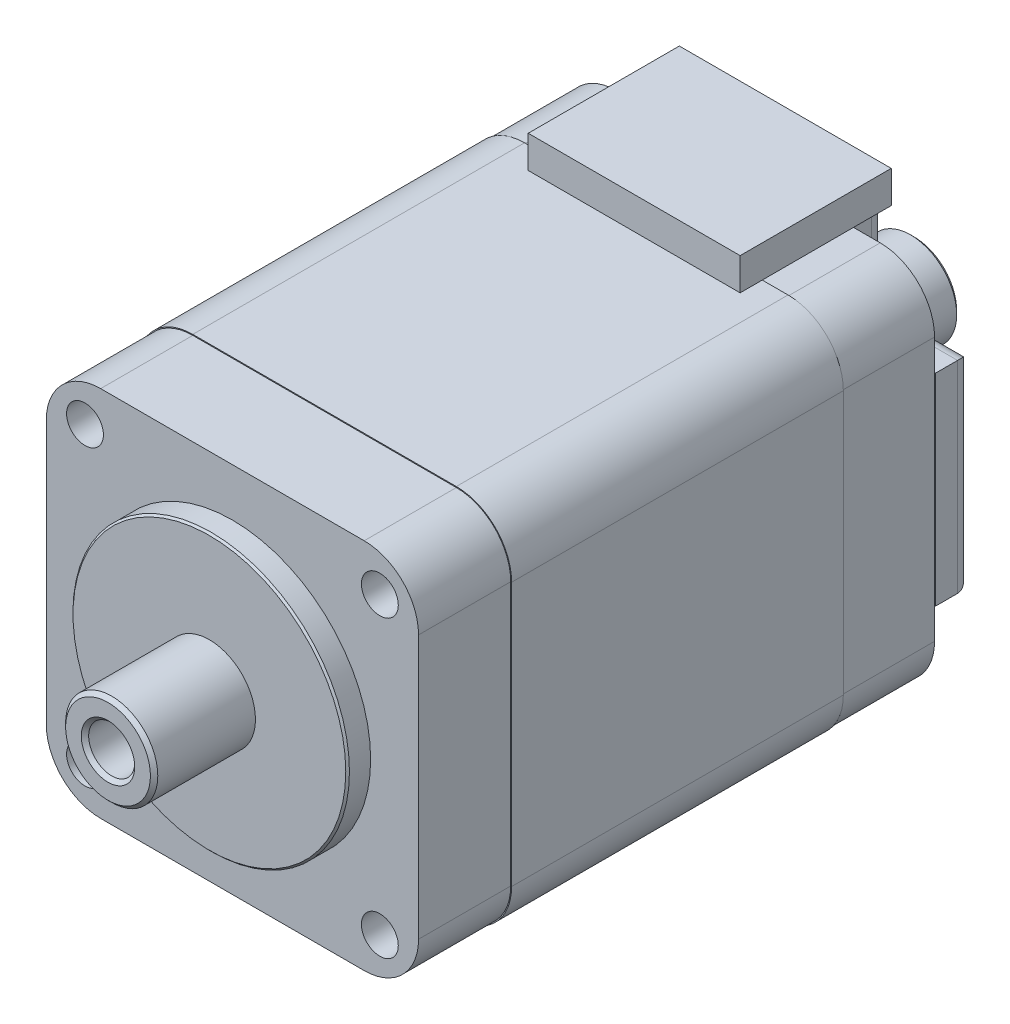
from build123d import *

# Parameters (mm, degrees)
SKETCH1_W               = 28
SKETCH1_H               = 20.3
BOSS_EXTRUDE1_DEPTH     = 10.15
SKETCH2_R               = 7.5
BOSS_EXTRUDE2_DEPTH     = 1.25
SKETCH3_R               = 2.5
BOSS_EXTRUDE3_DEPTH     = 5.5
CUT_EXTRUDE1_DEPTH      = 38.59797202
CUT_EXTRUDE1_DEPTH_BACK = 38.59797202
SKETCH4_R               = 1.25
CHAMFER1_SIZE           = 0.2
SKETCH6_R               = 2.5
SKETCH6_R_2             = 1.25
BOSS_EXTRUDE4_DEPTH     = 9
CHAMFER4_SIZE           = 0.2
SKETCH7_R               = 1
CUT_EXTRUDE2_DEPTH      = 40.686836609
FILLET1_R               = 3
SKETCH10_R              = 2.6
BOSS_EXTRUDE5_DEPTH     = 2
FILLET2_R               = 0.8
SKETCH13_W              = 11.5
SKETCH13_H              = 8.2
BOSS_EXTRUDE7_DEPTH     = 1.75
CUT_EXTRUDE5_DEPTH      = 5
CUT_EXTRUDE6_START      = -5
CUT_EXTRUDE6_DEPTH      = 5
CHAMFER5_SIZE           = 0.1


with BuildPart() as part:
    # Sketch1 → Boss-Extrude1 (new, symmetric)
    with BuildSketch(Plane(origin=(0, 0, 0), x_dir=(0, 0, -1), z_dir=(1, 0, 0))):
        Rectangle(SKETCH1_W, SKETCH1_H)
    extrude(amount=BOSS_EXTRUDE1_DEPTH, both=True)

    # Sketch2 → Boss-Extrude2 (add)
    with BuildSketch(Plane.XY.offset(14)):
        with Locations(Location((0, 0, 0), (0, 0, 180))):
            Circle(SKETCH2_R)
    extrude(amount=BOSS_EXTRUDE2_DEPTH)

    # Sketch3 → Boss-Extrude3 (add)
    with BuildSketch(Plane.XY.offset(15.25)):
        Circle(SKETCH3_R)
    extrude(amount=BOSS_EXTRUDE3_DEPTH)

    # Sketch4 → Cut-Extrude1 (cut, two sides: drawn at the far end of the back side and taken through both)
    with BuildSketch(Plane.XY.offset(20.75).offset(-CUT_EXTRUDE1_DEPTH_BACK)):
        Circle(SKETCH4_R)
    extrude(amount=CUT_EXTRUDE1_DEPTH + CUT_EXTRUDE1_DEPTH_BACK, mode=Mode.SUBTRACT)

    # Chamfer1
    chamfer1_edges = [part.edges().sort_by_distance(p)[0] for p in [
        (-2.5, 0, 20.75),
        (-1.25, 0, 20.75),
    ]]
    chamfer(chamfer1_edges, length=CHAMFER1_SIZE)

    # Sketch6 → Boss-Extrude4 (add)
    with BuildSketch(Plane(origin=(0, 0, -14), x_dir=(-1, 0, 0), z_dir=(0, 0, -1))):
        with Locations(Location((0, 0, 0), (0, 0, 180))):
            Circle(SKETCH6_R)
        with Locations(Location((0, 0, 0), (0, 0, 180))):
            Circle(SKETCH6_R_2, mode=Mode.SUBTRACT)
    extrude(amount=BOSS_EXTRUDE4_DEPTH)

    # Chamfer4
    chamfer4_edges = [part.edges().sort_by_distance(p)[0] for p in [
        (-2.5, 0, -23),
        (-1.25, 0, -23),
    ]]
    chamfer(chamfer4_edges, length=CHAMFER4_SIZE)

    # Sketch7 → Cut-Extrude2 (cut, through all)
    with BuildSketch(Plane.XY.offset(14)):
        with Locations((-8, 8)):
            Circle(SKETCH7_R)
        with Locations((8, 8)):
            Circle(SKETCH7_R)
        with Locations((8, -8)):
            Circle(SKETCH7_R)
        with Locations((-8, -8)):
            Circle(SKETCH7_R)
    extrude(amount=-CUT_EXTRUDE2_DEPTH, mode=Mode.SUBTRACT)

    # Fillet1
    fillet1_edges = [part.edges().sort_by_distance(p)[0] for p in [
        (10.15, -10.15, 0),
        (-10.15, -10.15, 0),
        (-10.15, 10.15, 0),
        (10.15, 10.15, 0),
    ]]
    fillet(fillet1_edges, radius=FILLET1_R)

    # Sketch13 → Boss-Extrude7 (add)
    with BuildSketch(Plane(origin=(0, 10.15, 0), x_dir=(1, 0, 0), z_dir=(0, 1, 0))):
        with Locations((0, 11.9)):
            Rectangle(SKETCH13_W, SKETCH13_H)
    extrude(amount=BOSS_EXTRUDE7_DEPTH)

    # Sketch14 → Cut-Extrude5 (cut)
    with BuildSketch(Plane.XY.offset(14)):
        with BuildLine():
            Line((10.15, -7.15), (10.15, 7.15))
            ThreePointArc((10.15, 7.15), (9.271320344, 9.271320344), (7.15, 10.15))
            Line((7.15, 10.15), (-7.15, 10.15))
            ThreePointArc((-7.15, 10.15), (-9.271320344, 9.271320344), (-10.15, 7.15))
            Line((-10.15, 7.15), (-10.15, -7.15))
            ThreePointArc((-10.15, -7.15), (-9.271320344, -9.271320344), (-7.15, -10.15))
            Line((-7.15, -10.15), (7.15, -10.15))
            ThreePointArc((7.15, -10.15), (9.271320344, -9.271320344), (10.15, -7.15))
        make_face()
        with BuildLine():
            Line((10.1, -7.15), (10.1, 7.15))
            ThreePointArc((10.1, 7.15), (9.235965005, 9.235965005), (7.15, 10.1))
            Line((7.15, 10.1), (-7.15, 10.1))
            ThreePointArc((-7.15, 10.1), (-9.235965005, 9.235965005), (-10.1, 7.15))
            Line((-10.1, 7.15), (-10.1, -7.15))
            ThreePointArc((-10.1, -7.15), (-9.235965005, -9.235965005), (-7.15, -10.1))
            Line((-7.15, -10.1), (7.15, -10.1))
            ThreePointArc((7.15, -10.1), (9.235965005, -9.235965005), (10.1, -7.15))
        make_face(mode=Mode.SUBTRACT)
    extrude(amount=-CUT_EXTRUDE5_DEPTH, mode=Mode.SUBTRACT)

    # Sketch15 → Cut-Extrude6 (cut)
    with BuildSketch(Plane(origin=(0, 0, -14), x_dir=(-1, 0, 0), z_dir=(0, 0, -1)).offset(CUT_EXTRUDE6_START)):
        with BuildLine():
            Line((7.15, 10.15), (5.75, 10.15))
            Line((5.75, 10.15), (-5.75, 10.15))
            Line((-5.75, 10.15), (-7.15, 10.15))
            ThreePointArc((-7.15, 10.15), (-9.271320344, 9.271320344), (-10.15, 7.15))
            Line((-10.15, 7.15), (-10.15, -7.15))
            ThreePointArc((-10.15, -7.15), (-9.271320344, -9.271320344), (-7.15, -10.15))
            Line((-7.15, -10.15), (7.15, -10.15))
            ThreePointArc((7.15, -10.15), (9.271320344, -9.271320344), (10.15, -7.15))
            Line((10.15, -7.15), (10.15, 7.15))
            ThreePointArc((10.15, 7.15), (9.271320344, 9.271320344), (7.15, 10.15))
        make_face()
        with BuildLine():
            Line((-10.1, 7.15), (-10.1, -7.15))
            ThreePointArc((-10.1, -7.15), (-9.235965005, -9.235965005), (-7.15, -10.1))
            Line((-7.15, -10.1), (7.15, -10.1))
            ThreePointArc((7.15, -10.1), (9.235965005, -9.235965005), (10.1, -7.15))
            Line((10.1, -7.15), (10.1, 7.15))
            ThreePointArc((10.1, 7.15), (9.235965005, 9.235965005), (7.15, 10.1))
            Line((7.15, 10.1), (-7.15, 10.1))
            ThreePointArc((-7.15, 10.1), (-9.235965005, 9.235965005), (-10.1, 7.15))
        make_face(mode=Mode.SUBTRACT)
    extrude(amount=CUT_EXTRUDE6_DEPTH, mode=Mode.SUBTRACT)

    # Chamfer5
    chamfer5_edges = [part.edges().sort_by_distance(p)[0] for p in [
        (7.5, 0, 15.25),
    ]]
    chamfer(chamfer5_edges, length=CHAMFER5_SIZE)


with BuildPart() as body_2:
    # Sketch10 → Boss-Extrude5 (new body)
    with BuildSketch(Plane(origin=(0, 0, -14), x_dir=(-1, 0, 0), z_dir=(0, 0, -1))):
        with BuildLine():
            Line((-7.7, 5.475), (-10.15, 5.475))
            Line((-10.15, 5.475), (-10.15, -5.475))
            Line((-10.15, -5.475), (-7.7, -5.475))
            ThreePointArc((-7.7, -5.475), (-6.126687412, -6.126687412), (-5.475, -7.7))
            Line((-5.475, -7.7), (-5.475, -10.15))
            Line((-5.475, -10.15), (5.475, -10.15))
            Line((5.475, -10.15), (5.475, -7.7))
            ThreePointArc((5.475, -7.7), (6.126687412, -6.126687412), (7.7, -5.475))
            Line((7.7, -5.475), (10.15, -5.475))
            Line((10.15, -5.475), (10.15, 5.475))
            Line((10.15, 5.475), (7.7, 5.475))
            ThreePointArc((7.7, 5.475), (6.126687412, 6.126687412), (5.475, 7.7))
            Line((5.475, 7.7), (5.475, 10.15))
            Line((5.475, 10.15), (-5.475, 10.15))
            Line((-5.475, 10.15), (-5.475, 7.7))
            ThreePointArc((-5.475, 7.7), (-6.126687412, 6.126687412), (-7.7, 5.475))
        make_face()
        Circle(SKETCH10_R, mode=Mode.SUBTRACT)
    extrude(amount=BOSS_EXTRUDE5_DEPTH)

    # Fillet2
    fillet2_edges = [body_2.edges().sort_by_distance(p)[0] for p in [
        (5.475, 8.925, -16),
        (6.126687412, 6.126687412, -16),
        (8.925, 5.475, -16),
        (10.15, 0, -16),
        (8.925, -5.475, -16),
        (6.126687412, -6.126687412, -16),
        (5.475, -8.925, -16),
        (0, -10.15, -16),
        (-5.475, -8.925, -16),
        (-6.126687412, -6.126687412, -16),
        (-8.925, -5.475, -16),
        (-10.15, 0, -16),
        (-8.925, 5.475, -16),
        (-6.126687412, 6.126687412, -16),
        (-5.475, 8.925, -16),
    ]]
    fillet(fillet2_edges, radius=FILLET2_R)


solid = Compound([part.part, body_2.part])
